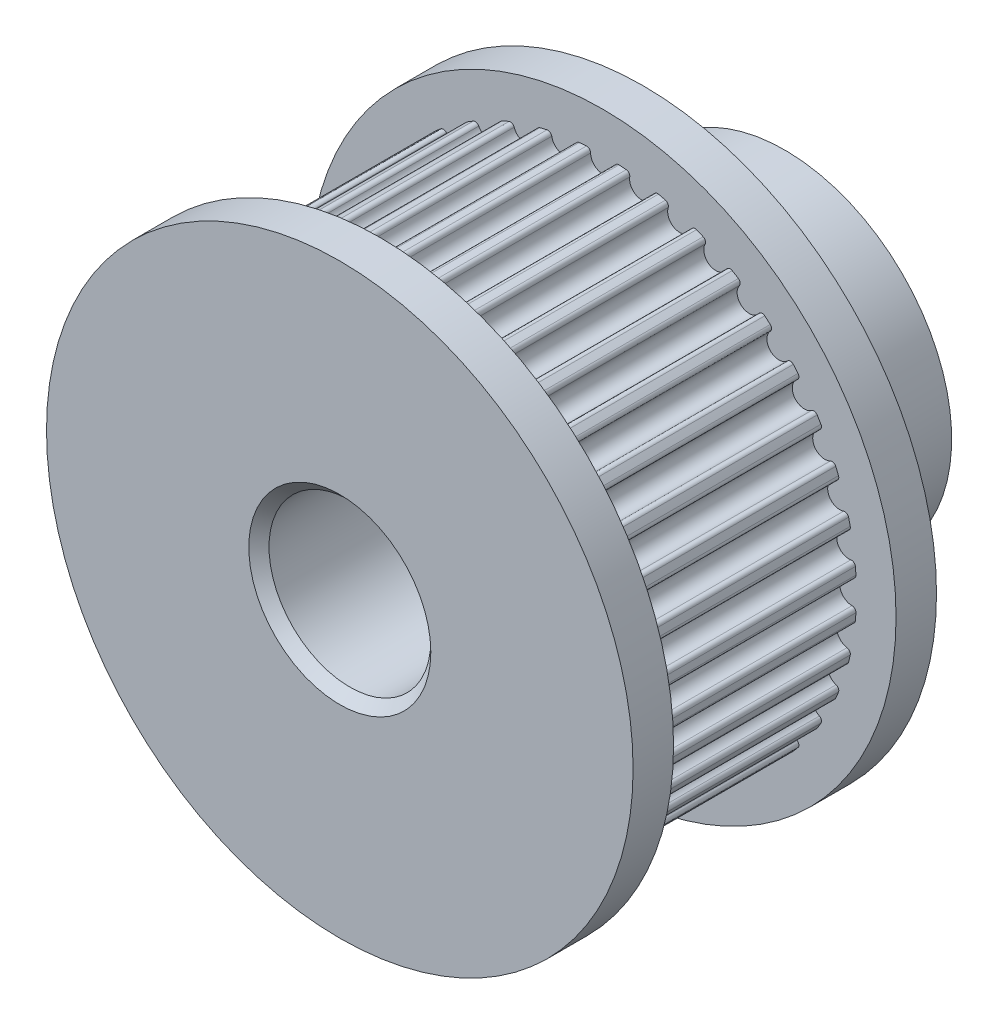
from build123d import *

# Parameters (mm, degrees)
SKETCHREVOLVEGEARBELT02_W       = 11
SKETCHREVOLVEGEARBELT02_H       = 12.541895259
TOOTHEXTRUDECUTGEARBELT02_DEPTH = 5.5
PATTERNGEARBELT02_COUNT         = 40
SKETCH_5_R                      = 14.5
EXTRUDE_1_DEPTH                 = 2
EXTRUDE_START                   = 2
SKETCH_6_R                      = 14.5
EXTRUDE_2_DEPTH                 = 2
SKETCH_7_R                      = 8.25
EXTRUDE_3_DEPTH                 = 7
CUT_EXTRUDE_2_DEPTH             = 26.11473671
CUT_EXTRUDE_2_DEPTH_BACK        = 26.11473671
SKETCH_8_R                      = 4
CHAMFER_1_SIZE                  = 0.5


with BuildPart() as part:
    # SketchRevolveGearBelt02 → GearBelt02 (revolve)
    with BuildSketch(Plane(origin=(0, 0, 0), x_dir=(0, 0, -1), z_dir=(1, 0, 0))):
        with Locations((0, 6.27094763)):
            Rectangle(SKETCHREVOLVEGEARBELT02_W, SKETCHREVOLVEGEARBELT02_H)
    revolve(axis=Axis((0, 0, 5.5), (0, 0, -1)))

    # SketchToothGearBelt02 → ToothExtrudeCutGearBelt02 (cut, symmetric)
    with BuildSketch(Plane.XY):
        with BuildLine():
            Line((-0.805912611, 12.515975453), (0, 15.081895221))
            Line((0, 15.081895221), (0.805912611, 12.515975453))
            ThreePointArc((0.805912611, 12.515975453), (0.661137539, 12.464033463), (0.599999991, 12.322895262))
            ThreePointArc((0.599999991, 12.322895262), (0, 11.722895271), (-0.599999991, 12.322895262))
            ThreePointArc((-0.599999991, 12.322895262), (-0.661137539, 12.464033463), (-0.805912611, 12.515975453))
        make_face()
    toothextrudecutgearbelt02 = extrude(amount=TOOTHEXTRUDECUTGEARBELT02_DEPTH, both=True, mode=Mode.SUBTRACT)

    # PatternGearBelt02: ToothExtrudeCutGearBelt02 ×40 about axis
    patterngearbelt02_axis = Axis((0, 0, 55), (0, 0, -1))
    for i in range(1, PATTERNGEARBELT02_COUNT):
        add(toothextrudecutgearbelt02.rotate(patterngearbelt02_axis, i * 360 / PATTERNGEARBELT02_COUNT), mode=Mode.SUBTRACT)

    # Эскиз5 → Бобышка-Вытянуть1 (add)
    with BuildSketch(Plane.XY.offset(5.5)):
        Circle(SKETCH_5_R)
    extrude(amount=EXTRUDE_1_DEPTH)

    # Эскиз6 → Бобышка-Вытянуть2 (add)
    with BuildSketch(Plane(origin=(0, 0, -5.5), x_dir=(-1, 0, 0), z_dir=(0, 0, -1)).offset(EXTRUDE_START)):
        Circle(SKETCH_6_R)
    extrude(amount=-EXTRUDE_2_DEPTH)

    # Эскиз7 → Бобышка-Вытянуть3 (add)
    with BuildSketch(Plane(origin=(0, 0, -7.5), x_dir=(-1, 0, 0), z_dir=(0, 0, -1))):
        Circle(SKETCH_7_R)
    extrude(amount=EXTRUDE_3_DEPTH)

    # Эскиз8 → Вырез-Вытянуть2 (cut, two sides: drawn at the far end of the back side and taken through both)
    with BuildSketch(Plane.XY.offset(-CUT_EXTRUDE_2_DEPTH_BACK)):
        Circle(SKETCH_8_R)
    extrude(amount=CUT_EXTRUDE_2_DEPTH + CUT_EXTRUDE_2_DEPTH_BACK, mode=Mode.SUBTRACT)

    # Фаска1
    chamfer_1_edges = [part.edges().sort_by_distance(p)[0] for p in [
        (-4, 0, 7.5),
        (-4, 0, -14.5),
    ]]
    chamfer(chamfer_1_edges, length=CHAMFER_1_SIZE)


solid = part.part
